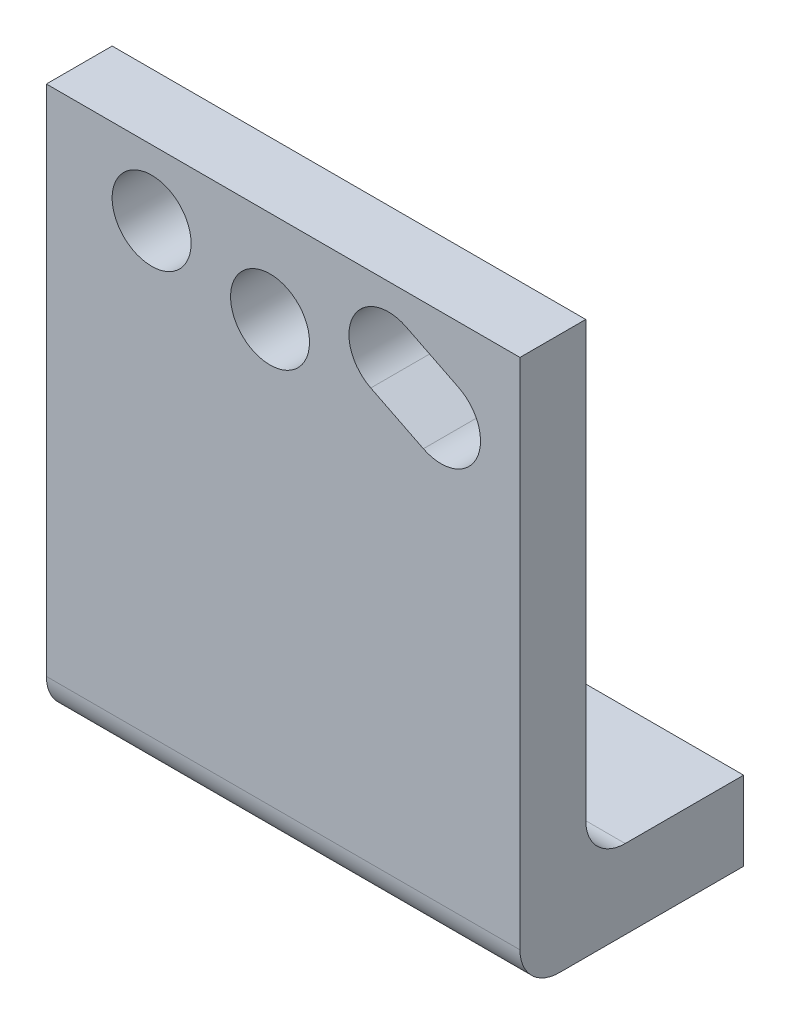
from build123d import *

# Parameters (mm, degrees)
SKETCH1_W           = 18
SKETCH1_H           = 21
SKETCH1_R           = 1.5
BOSS_EXTRUDE1_DEPTH = 2.5
SKETCH1_3_W         = 18
SKETCH1_3_H         = 3
BOSS_EXTRUDE2_DEPTH = 6
FILLET1_R           = 1.5


with BuildPart() as part:
    # Sketch1 → Boss-Extrude1 (new body)
    with BuildSketch(Plane.XY):
        Rectangle(SKETCH1_W, SKETCH1_H)
        with Locations((-5, 8)):
            Circle(SKETCH1_R, mode=Mode.SUBTRACT)
        with Locations((-0.5, 7)):
            Circle(SKETCH1_R, mode=Mode.SUBTRACT)
        with BuildLine():
            ThreePointArc((3.329179607, 6.658359214), (2.658359214, 8.670820393), (4.670820393, 9.341640786))
            Line((4.670820393, 9.341640786), (6.670820393, 8.341640786))
            ThreePointArc((6.670820393, 8.341640786), (7.341640786, 6.329179607), (5.329179607, 5.658359214))
            Line((5.329179607, 5.658359214), (3.329179607, 6.658359214))
        make_face(mode=Mode.SUBTRACT)
    extrude(amount=BOSS_EXTRUDE1_DEPTH)

    # Sketch1<3> → Boss-Extrude2 (add)
    with BuildSketch(Plane.XY):
        with Locations((0, -9)):
            Rectangle(SKETCH1_3_W, SKETCH1_3_H)
    extrude(amount=-BOSS_EXTRUDE2_DEPTH)

    # Fillet1
    fillet1_edges = [part.edges().sort_by_distance(p)[0] for p in [
        (0, -10.5, 2.5),
        (0, -7.5, 0),
    ]]
    fillet(fillet1_edges, radius=FILLET1_R)


solid = part.part
